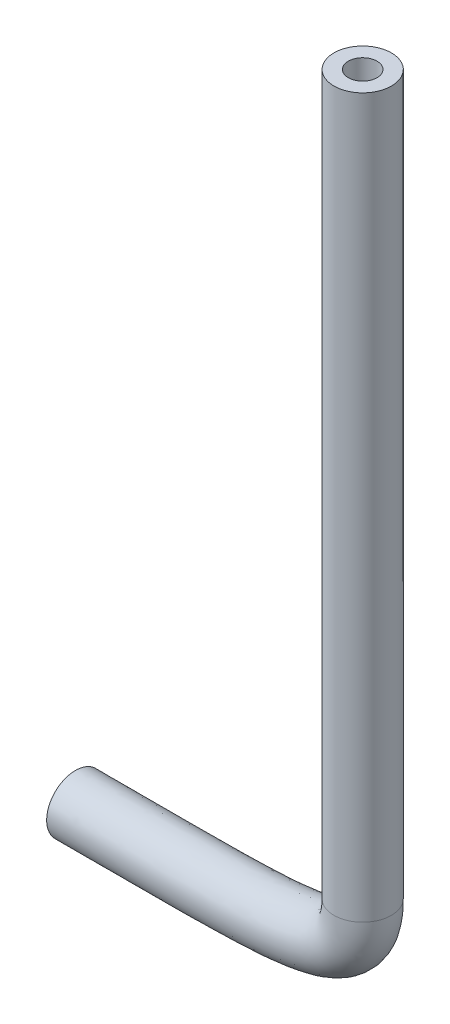
from build123d import *

# Parameters (mm, degrees)
PIPERING_R   = 0.8
PIPERING_R_2 = 0.4


with BuildPart() as part:
    # Pipe: sweep along a path in PipeSke
    with BuildLine() as pipe_path:  # in the path sketch's own coordinates; laid on its plane below (add() does not lay a ready-made edge on the line's plane)
        Line((-2, 0), (0, 0))
        add(Edge.make_bspline(
            [(0, 0), (4.619948081, 0), (6, 0.035966381), (6, 1.704499781)],
            knots=[0, 0, 0, 0, 1, 1, 1, 1], degree=3))
        Line((6, 1.704499781), (6, 21.704499781))
    # PipeRing → Pipe (sweep)
    with BuildSketch(Plane(origin=(0, 0, 0), x_dir=(0, 0, -1), z_dir=(1, 0, 0))):
        Circle(PIPERING_R)
        Circle(PIPERING_R_2, mode=Mode.SUBTRACT)
    sweep(path=Plane.XY * pipe_path.line)


solid = part.part
